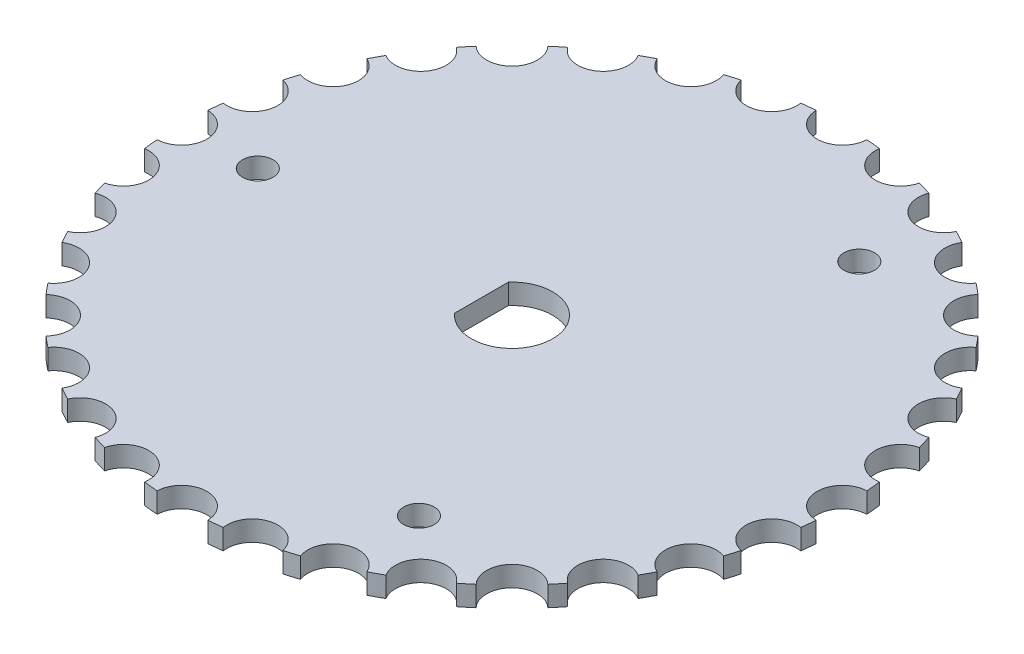
from build123d import *

# Parameters (mm, degrees)
SKETCH1_R           = 32.5
BOSS_EXTRUDE1_DEPTH = 2
CUT_EXTRUDE2_DEPTH  = 47.005434462
SKETCH2_R           = 2.5
CUT_EXTRUDE1_DEPTH  = 47.005434462
SKETCH5_R           = 1.5
CUT_EXTRUDE3_DEPTH  = 10


with BuildPart() as part:
    # Sketch1 → Boss-Extrude1 (new body)
    with BuildSketch(Plane(origin=(0, 0, 0), x_dir=(1, 0, 0), z_dir=(0, 1, 0))):
        with Locations(Location((0, 0, 0), (0, 0, 270))):
            Circle(SKETCH1_R)
    extrude(amount=BOSS_EXTRUDE1_DEPTH)

    # Sketch4 → Cut-Extrude2 (cut, through all)
    with BuildSketch(Plane(origin=(0, 2, 0), x_dir=(1, 0, 0), z_dir=(0, 1, 0))):
        with BuildLine():
            Line((-3, -2.645751311), (-3, 2.645751311))
            ThreePointArc((-3, 2.645751311), (4, 0), (-3, -2.645751311))
        make_face()
    extrude(amount=-CUT_EXTRUDE2_DEPTH, mode=Mode.SUBTRACT)

    # Sketch2 → Cut-Extrude1 (cut, through all)
    with BuildSketch(Plane(origin=(0, 2, 0), x_dir=(1, 0, 0), z_dir=(0, 1, 0))):
        with Locations((-30.026084807, -12.437211552)):
            Circle(SKETCH2_R)
        with Locations((-32.5, 0)):
            Circle(SKETCH2_R)
        with Locations((-31.875521613, 6.340435466)):
            Circle(SKETCH2_R)
        with Locations((-30.026084807, 12.437211552)):
            Circle(SKETCH2_R)
        with Locations((-27.0227624, 18.056032573)):
            Circle(SKETCH2_R)
        with Locations((-22.980970389, 22.980970389)):
            Circle(SKETCH2_R)
        with Locations((-18.056032573, 27.0227624)):
            Circle(SKETCH2_R)
        with Locations((-12.437211552, 30.026084807)):
            Circle(SKETCH2_R)
        with Locations((-6.340435466, 31.875521613)):
            Circle(SKETCH2_R)
        with Locations((0, 32.5)):
            Circle(SKETCH2_R)
        with Locations((6.340435466, 31.875521613)):
            Circle(SKETCH2_R)
        with Locations((12.437211552, 30.026084807)):
            Circle(SKETCH2_R)
        with Locations((18.056032573, 27.0227624)):
            Circle(SKETCH2_R)
        with Locations((22.980970389, 22.980970389)):
            Circle(SKETCH2_R)
        with Locations((27.0227624, 18.056032573)):
            Circle(SKETCH2_R)
        with Locations((30.026084807, 12.437211552)):
            Circle(SKETCH2_R)
        with Locations((31.875521613, 6.340435466)):
            Circle(SKETCH2_R)
        with Locations((32.5, 0)):
            Circle(SKETCH2_R)
        with Locations((31.875521613, -6.340435466)):
            Circle(SKETCH2_R)
        with Locations((30.026084807, -12.437211552)):
            Circle(SKETCH2_R)
        with Locations((27.0227624, -18.056032573)):
            Circle(SKETCH2_R)
        with Locations((22.980970389, -22.980970389)):
            Circle(SKETCH2_R)
        with Locations((18.056032573, -27.0227624)):
            Circle(SKETCH2_R)
        with Locations((12.437211552, -30.026084807)):
            Circle(SKETCH2_R)
        with Locations((6.340435466, -31.875521613)):
            Circle(SKETCH2_R)
        with Locations((0, -32.5)):
            Circle(SKETCH2_R)
        with Locations((-6.340435466, -31.875521613)):
            Circle(SKETCH2_R)
        with Locations((-12.437211552, -30.026084807)):
            Circle(SKETCH2_R)
        with Locations((-18.056032573, -27.0227624)):
            Circle(SKETCH2_R)
        with Locations((-22.980970389, -22.980970389)):
            Circle(SKETCH2_R)
        with Locations((-27.0227624, -18.056032573)):
            Circle(SKETCH2_R)
        with Locations((-31.875521613, -6.340435466)):
            Circle(SKETCH2_R)
    extrude(amount=-CUT_EXTRUDE1_DEPTH, mode=Mode.SUBTRACT)

    # Sketch5 → Cut-Extrude3 (cut)
    with BuildSketch(Plane(origin=(0, 2, 0), x_dir=(1, 0, 0), z_dir=(0, 1, 0))):
        with Locations(Location((-25, 0, 0), (0, 0, 270))):
            Circle(SKETCH5_R)
        with Locations(Location((12.5, 21.650635095, 0), (0, 0, 270))):
            Circle(SKETCH5_R)
        with Locations(Location((12.5, -21.650635095, 0), (0, 0, 270))):
            Circle(SKETCH5_R)
    extrude(amount=-CUT_EXTRUDE3_DEPTH, mode=Mode.SUBTRACT)


solid = part.part
